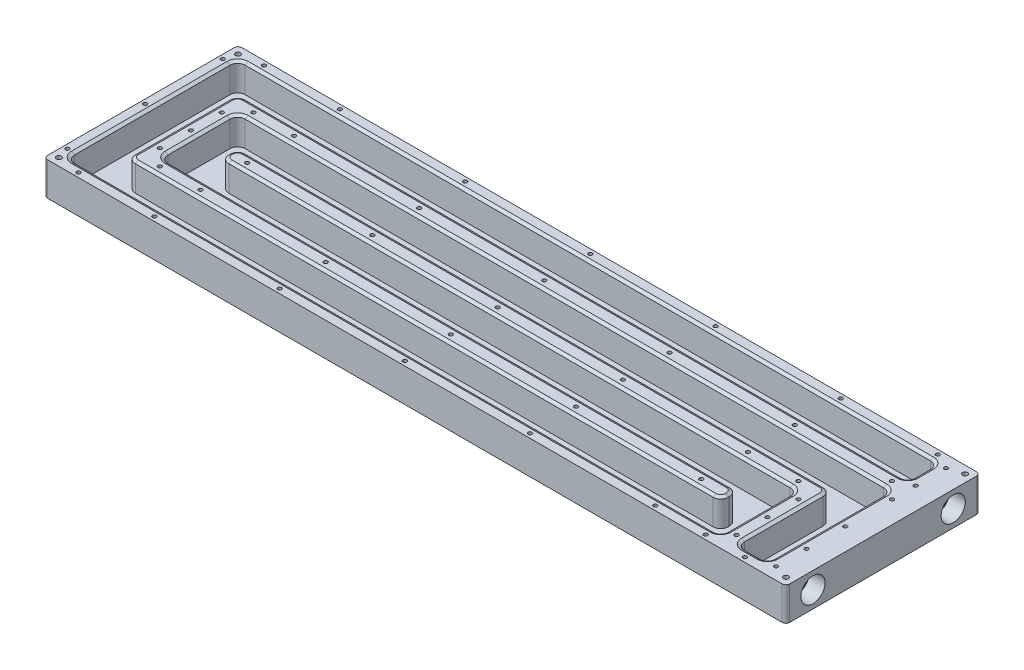
from build123d import *

# Parameters (mm, degrees)
SKETCH1_W                                  = 488.95
SKETCH1_H                                  = 134
BOSS_EXTRUDE1_DEPTH                        = 22
F_3_8_NPT_TAPPED_HOLE1_AT_2_COUNT          = 2
F_3_8_NPT_TAPPED_HOLE1_AT_2_PITCH          = 92.4
SKETCH4_W                                  = 461.45
SKETCH4_H                                  = 20
CUT_EXTRUDE1_DEPTH                         = 18
LPATTERN1_COUNT                            = 4
LPATTERN1_PITCH                            = 30.8
BOSS_EXTRUDE2_REACH                        = 256.443
SKETCH5_W                                  = 30.8
SKETCH5_H                                  = 20
BOSS_EXTRUDE3_REACH                        = 256.443
SKETCH6_W                                  = 30.8
SKETCH6_H                                  = 20
SKETCH7_W                                  = 20
SKETCH7_H                                  = 61.6
CUT_EXTRUDE2_DEPTH                         = 18
SKETCH8_W                                  = 20
SKETCH8_H                                  = 10.8
CUT_EXTRUDE3_DEPTH                         = 18
SKETCH9_W                                  = 20
SKETCH9_H                                  = 72.4
CUT_EXTRUDE4_DEPTH                         = 18
SKETCH10_W                                 = 20
SKETCH10_H                                 = 10.8
CUT_EXTRUDE5_DEPTH                         = 18
FILLET1_R                                  = 5
CHAMFER1_SIZE                              = 2
CHAMFER1_SIZE2                             = 1.154700538
TAP_DRILL_FOR_M3X0_5_PLATE_NEXT_MO_2_COUNT = 2
TAP_DRILL_FOR_M3X0_5_PLATE_NEXT_MO_2_PITCH = 61.6
LPATTERN2_COUNT                            = 5
LPATTERN2_PITCH                            = 97.75
SKETCH15_W                                 = 488.95
SKETCH15_H                                 = 3
CUT_EXTRUDE6_DEPTH                         = 255.442578247
SKETCH16_W                                 = 488.95
SKETCH16_H                                 = 3
CUT_EXTRUDE7_DEPTH                         = 255.442578247
FILLET2_R                                  = 2.5
TAP_DRILL_FOR_M3X0_5_TAP1_AT_2_COUNT       = 2
TAP_DRILL_FOR_M3X0_5_TAP1_AT_2_PITCH       = 30.8
TAP_DRILL_FOR_M3X0_5_TAP1_AT_3_COUNT       = 2
TAP_DRILL_FOR_M3X0_5_TAP1_AT_3_PITCH       = 61.1
TAP_DRILL_FOR_M3X0_5_TAP1_AT_4_COUNT       = 2
TAP_DRILL_FOR_M3X0_5_TAP1_AT_4_PITCH       = 30.8
TAP_DRILL_FOR_M3X0_5_TAP1_AT_5_COUNT       = 2
TAP_DRILL_FOR_M3X0_5_TAP1_AT_5_PITCH       = 61.1
LPATTERN3_COUNT                            = 5
LPATTERN3_PITCH                            = 82.5
TAP_DRILL_FOR_M3X0_5_TAP3_D                = 2.5
TAP_DRILL_FOR_M3X0_5_TAP3_DEPTH            = 10
TAP_DRILL_FOR_M3X0_5_TAP3_TIP              = 0.751075774
TAP_DRILL_FOR_M3X0_5_TAP4_D                = 2.5
TAP_DRILL_FOR_M3X0_5_TAP4_DEPTH            = 10
TAP_DRILL_FOR_M3X0_5_TAP4_TIP              = 0.751075774
TAP_DRILL_FOR_M4X0_7_TAP1_D                = 3.3
TAP_DRILL_FOR_M4X0_7_TAP1_DEPTH            = 17.38
TAP_DRILL_FOR_M4X0_7_TAP1_TIP              = 0.991420021
TAP_DRILL_FOR_M3X0_5_TAP5_D                = 2.5
TAP_DRILL_FOR_M3X0_5_TAP5_DEPTH            = 10
TAP_DRILL_FOR_M3X0_5_TAP5_TIP              = 0.751075774


with BuildPart() as part:
    # Sketch1 → Boss-Extrude1 (new body)
    with BuildSketch(Plane(origin=(0, 0, 0), x_dir=(1, 0, 0), z_dir=(0, 1, 0))):
        Rectangle(SKETCH1_W, SKETCH1_H)
    extrude(amount=BOSS_EXTRUDE1_DEPTH)

    # Sketch3 → 3/8 NPT Tapped Hole1 (revolve, cut)
    with BuildSketch(Plane(origin=(244.475, 11, 46.2), x_dir=(0, 0, -1), z_dir=(0, 1, 0))):
        Polygon((0, 0), (0, 21.668582582), (7.1374, 17.38), (7.1374, 10.33), (7.653732966, 10.33), (7.963027, 0), align=None)
    f_3_8_npt_tapped_hole1 = revolve(axis=Axis((250.825, 11, 46.2), (-1, 0, 0)), mode=Mode.SUBTRACT)

    # 3/8 NPT Tapped Hole1 at 2: 3/8 NPT Tapped Hole1 ×2
    with Locations(*[(0, 0, -i * F_3_8_NPT_TAPPED_HOLE1_AT_2_PITCH) for i in range(1, F_3_8_NPT_TAPPED_HOLE1_AT_2_COUNT)]):
        add(f_3_8_npt_tapped_hole1, mode=Mode.SUBTRACT)

    # Sketch4 → Cut-Extrude1 (cut)
    with BuildSketch(Plane(origin=(0, 22, 0), x_dir=(1, 0, 0), z_dir=(0, 1, 0))):
        with Locations((-6.25, 46.2)):
            Rectangle(SKETCH4_W, SKETCH4_H)
    cut_extrude1 = extrude(amount=-CUT_EXTRUDE1_DEPTH, mode=Mode.SUBTRACT)

    # LPattern1: Cut-Extrude1 ×4
    with Locations(*[(0, 0, i * LPATTERN1_PITCH) for i in range(1, LPATTERN1_COUNT)]):
        add(cut_extrude1, mode=Mode.SUBTRACT)

    # Sketch5 → Boss-Extrude2 (add, up to next)
    with BuildSketch(Plane(origin=(0, 22, 0), x_dir=(1, 0, 0), z_dir=(0, 1, 0)), mode=Mode.PRIVATE) as boss_extrude2_sk1:
        with Locations((-221.575, -15.4)):
            Rectangle(SKETCH5_W, SKETCH5_H)
    boss_extrude2_tool1 = extrude(boss_extrude2_sk1.sketch, amount=-BOSS_EXTRUDE2_REACH, mode=Mode.PRIVATE) - part.part
    # Sketch5 → Boss-Extrude2 (add, up to next)
    with BuildSketch(Plane(origin=(0, 22, 0), x_dir=(1, 0, 0), z_dir=(0, 1, 0)), mode=Mode.PRIVATE) as boss_extrude2_sk2:
        with Locations((-221.575, 15.4)):
            Rectangle(SKETCH5_W, SKETCH5_H)
    boss_extrude2_tool2 = extrude(boss_extrude2_sk2.sketch, amount=-BOSS_EXTRUDE2_REACH, mode=Mode.PRIVATE) - part.part
    add(boss_extrude2_tool1.solids().sort_by_distance((-221.575, 22, 15.4))[0])
    add(boss_extrude2_tool2.solids().sort_by_distance((-221.575, 22, -15.4))[0])

    # Sketch6 → Boss-Extrude3 (add, up to next)
    with BuildSketch(Plane(origin=(0, 22, 0), x_dir=(1, 0, 0), z_dir=(0, 1, 0)), mode=Mode.PRIVATE) as boss_extrude3_sk1:
        with Locations((209.075, -46.2)):
            Rectangle(SKETCH6_W, SKETCH6_H)
    boss_extrude3_tool1 = extrude(boss_extrude3_sk1.sketch, amount=-BOSS_EXTRUDE3_REACH, mode=Mode.PRIVATE) - part.part
    # Sketch6 → Boss-Extrude3 (add, up to next)
    with BuildSketch(Plane(origin=(0, 22, 0), x_dir=(1, 0, 0), z_dir=(0, 1, 0)), mode=Mode.PRIVATE) as boss_extrude3_sk2:
        with Locations((209.075, -15.4)):
            Rectangle(SKETCH6_W, SKETCH6_H)
    boss_extrude3_tool2 = extrude(boss_extrude3_sk2.sketch, amount=-BOSS_EXTRUDE3_REACH, mode=Mode.PRIVATE) - part.part
    add(boss_extrude3_tool1.solids().sort_by_distance((209.075, 22, 46.2))[0])
    add(boss_extrude3_tool2.solids().sort_by_distance((209.075, 22, 15.4))[0])

    # Sketch7 → Cut-Extrude2 (cut)
    with BuildSketch(Plane(origin=(0, 22, 0), x_dir=(1, 0, 0), z_dir=(0, 1, 0))):
        with Locations((214.475, -25.4)):
            Rectangle(SKETCH7_W, SKETCH7_H)
    extrude(amount=-CUT_EXTRUDE2_DEPTH, mode=Mode.SUBTRACT)

    # Sketch8 → Cut-Extrude3 (cut)
    with BuildSketch(Plane(origin=(0, 22, 0), x_dir=(1, 0, 0), z_dir=(0, 1, 0))):
        with Locations((183.675, -30.8)):
            Rectangle(SKETCH8_W, SKETCH8_H)
    extrude(amount=-CUT_EXTRUDE3_DEPTH, mode=Mode.SUBTRACT)

    # Sketch9 → Cut-Extrude4 (cut)
    with BuildSketch(Plane(origin=(0, 22, 0), x_dir=(1, 0, 0), z_dir=(0, 1, 0))):
        with Locations((-226.975, 0)):
            Rectangle(SKETCH9_W, SKETCH9_H)
    extrude(amount=-CUT_EXTRUDE4_DEPTH, mode=Mode.SUBTRACT)

    # Sketch10 → Cut-Extrude5 (cut)
    with BuildSketch(Plane(origin=(0, 22, 0), x_dir=(1, 0, 0), z_dir=(0, 1, 0))):
        with Locations((-196.175, 0)):
            Rectangle(SKETCH10_W, SKETCH10_H)
    extrude(amount=-CUT_EXTRUDE5_DEPTH, mode=Mode.SUBTRACT)

    # Fillet1
    fillet1_edges = [part.edges().sort_by_distance(p)[0] for p in [
        (-206.175, 13, 25.4),
        (193.675, 13, 5.4),
        (193.675, 13, 56.2),
        (204.475, 13, 56.2),
        (204.475, 13, -5.4),
        (224.475, 13, 56.2),
        (173.675, 13, 36.2),
        (173.675, 13, 25.4),
        (-216.975, 13, -36.2),
        (-216.975, 13, 36.2),
        (-186.175, 13, -5.4),
        (-186.175, 13, 5.4),
        (224.475, 13, -56.2),
        (224.475, 13, -36.2),
        (-236.975, 13, -56.2),
        (224.475, 13, -25.4),
        (-236.975, 13, 56.2),
        (-206.175, 13, -25.4),
    ]]
    fillet(fillet1_edges, radius=FILLET1_R)

    # Chamfer1
    chamfer1_edges = [part.edges().sort_by_distance(p)[0] for p in [
        (3.75, 22, 5.4),
        (193.675, 22, 30.8),
        (173.675, 22, 30.8),
        (-16.25, 22, 25.4),
        (-206.175, 22, 0),
        (9.15, 22, -25.4),
        (224.475, 22, 15.4),
        (214.475, 22, 56.2),
        (204.475, 22, 25.4),
        (9.15, 22, -5.4),
        (-186.175, 22, 0),
        (-21.65, 22, 56.2),
        (-236.975, 22, 0),
        (-6.25, 22, -56.2),
        (224.475, 22, -46.2),
        (3.75, 22, -36.2),
        (-216.975, 22, 0),
        (-21.65, 22, 36.2),
        (-184.710533906, 22, 3.935533906),
        (-184.710533906, 22, -3.935533906),
        (-215.510533906, 22, 34.735533906),
        (-215.510533906, 22, -34.735533906),
        (203.010533906, 22, -3.935533906),
        (172.210533906, 22, 34.735533906),
        (172.210533906, 22, 26.864466094),
        (192.210533906, 22, 6.864466094),
        (192.210533906, 22, 54.735533906),
        (205.939466094, 22, 54.735533906),
        (223.010533906, 22, 54.735533906),
        (223.010533906, 22, -23.935533906),
        (223.010533906, 22, -37.664466094),
        (223.010533906, 22, -54.735533906),
        (-235.510533906, 22, 54.735533906),
        (-204.710533906, 22, 23.935533906),
        (-204.710533906, 22, -23.935533906),
        (-235.510533906, 22, -54.735533906),
    ]]
    chamfer1_side = [part.faces().sort_by_distance(p)[0] for p in [
        (10.260026079, 22, -0.000428348),
    ]]
    chamfer(chamfer1_edges, length=CHAMFER1_SIZE, length2=CHAMFER1_SIZE2, reference=chamfer1_side[0])

    # Sketch14 → Tap Drill for M3x0.5 - Plate Next Mounts (revolve, cut)
    with BuildSketch(Plane(origin=(-191.975, 0, 30.8), x_dir=(0, 0, -1), z_dir=(1, 0, 0))):
        Polygon((0, 0), (0, 10.751075774), (1.25, 10), (1.25, 0), align=None)
    tap_drill_for_m3x0_5_plate_next_mounts = revolve(axis=Axis((-191.975, -6.35, 30.8), (0, 1, 0)), mode=Mode.SUBTRACT)

    # Tap Drill for M3x0.5 - Plate Next Mo 2: Tap Drill for M3x0.5 - Plate Next Mounts ×2
    with Locations(*[(0, 0, -i * TAP_DRILL_FOR_M3X0_5_PLATE_NEXT_MO_2_PITCH) for i in range(1, TAP_DRILL_FOR_M3X0_5_PLATE_NEXT_MO_2_COUNT)]):
        add(tap_drill_for_m3x0_5_plate_next_mounts, mode=Mode.SUBTRACT)

    # LPattern2: Tap Drill for M3x0.5 - Plate Next Mounts ×5
    with Locations(*[(i * LPATTERN2_PITCH, 0, 0) for i in range(1, LPATTERN2_COUNT)]):
        add(tap_drill_for_m3x0_5_plate_next_mounts, mode=Mode.SUBTRACT)

    # LPattern2 copy 1 sketch → LPattern2 copy 1 (revolve, cut)
    with BuildSketch(Plane(origin=(-94.225, 0, -30.8), x_dir=(0, 0, -1), z_dir=(1, 0, 0))):
        Polygon((0, 0), (0, 10.751075774), (1.25, 10), (1.25, 0), align=None)
    revolve(axis=Axis((-94.225, -6.35, -30.8), (0, 1, 0)), mode=Mode.SUBTRACT)

    # LPattern2 copy 2 sketch → LPattern2 copy 2 (revolve, cut)
    with BuildSketch(Plane(origin=(3.525, 0, -30.8), x_dir=(0, 0, -1), z_dir=(1, 0, 0))):
        Polygon((0, 0), (0, 10.751075774), (1.25, 10), (1.25, 0), align=None)
    revolve(axis=Axis((3.525, -6.35, -30.8), (0, 1, 0)), mode=Mode.SUBTRACT)

    # LPattern2 copy 3 sketch → LPattern2 copy 3 (revolve, cut)
    with BuildSketch(Plane(origin=(101.275, 0, -30.8), x_dir=(0, 0, -1), z_dir=(1, 0, 0))):
        Polygon((0, 0), (0, 10.751075774), (1.25, 10), (1.25, 0), align=None)
    revolve(axis=Axis((101.275, -6.35, -30.8), (0, 1, 0)), mode=Mode.SUBTRACT)

    # LPattern2 copy 4 sketch → LPattern2 copy 4 (revolve, cut)
    with BuildSketch(Plane(origin=(199.025, 0, -30.8), x_dir=(0, 0, -1), z_dir=(1, 0, 0))):
        Polygon((0, 0), (0, 10.751075774), (1.25, 10), (1.25, 0), align=None)
    revolve(axis=Axis((199.025, -6.35, -30.8), (0, 1, 0)), mode=Mode.SUBTRACT)

    # Sketch15 → Cut-Extrude6 (cut, through all)
    with BuildSketch(Plane(origin=(0, 22, 0), x_dir=(1, 0, 0), z_dir=(0, 1, 0))):
        with Locations((0, -65.5)):
            Rectangle(SKETCH15_W, SKETCH15_H)
    extrude(amount=-CUT_EXTRUDE6_DEPTH, mode=Mode.SUBTRACT)

    # Sketch16 → Cut-Extrude7 (cut, through all)
    with BuildSketch(Plane(origin=(0, 22, 0), x_dir=(1, 0, 0), z_dir=(0, 1, 0))):
        with Locations((0, 65.5)):
            Rectangle(SKETCH16_W, SKETCH16_H)
    extrude(amount=-CUT_EXTRUDE7_DEPTH, mode=Mode.SUBTRACT)

    # Fillet2
    fillet2_edges = [part.edges().sort_by_distance(p)[0] for p in [
        (244.475, 11, 64),
        (-244.475, 11, 64),
        (244.475, 11, -64),
        (-244.475, 11, -64),
    ]]
    fillet(fillet2_edges, radius=FILLET2_R)

    # Sketch12 → Tap Drill for M3x0.5 Tap1 (revolve, cut)
    with BuildSketch(Plane(origin=(-174.475, 22, 0), x_dir=(0, 0, 1), z_dir=(1, 0, 0))):
        Polygon((0, 0), (0, 10.751075774), (1.25, 10), (1.25, 0), align=None)
    tap_drill_for_m3x0_5_tap1 = revolve(axis=Axis((-174.475, 28.35, 0), (0, -1, 0)), mode=Mode.SUBTRACT)

    # Tap Drill for M3x0.5 Tap1 at 2: Tap Drill for M3x0.5 Tap1 ×2
    with Locations(*[(0, 0, i * TAP_DRILL_FOR_M3X0_5_TAP1_AT_2_PITCH) for i in range(1, TAP_DRILL_FOR_M3X0_5_TAP1_AT_2_COUNT)]):
        add(tap_drill_for_m3x0_5_tap1, mode=Mode.SUBTRACT)

    # Tap Drill for M3x0.5 Tap1 at 3: Tap Drill for M3x0.5 Tap1 ×2
    with Locations(*[(0, 0, i * TAP_DRILL_FOR_M3X0_5_TAP1_AT_3_PITCH) for i in range(1, TAP_DRILL_FOR_M3X0_5_TAP1_AT_3_COUNT)]):
        add(tap_drill_for_m3x0_5_tap1, mode=Mode.SUBTRACT)

    # Tap Drill for M3x0.5 Tap1 at 4: Tap Drill for M3x0.5 Tap1 ×2
    with Locations(*[(0, 0, -i * TAP_DRILL_FOR_M3X0_5_TAP1_AT_4_PITCH) for i in range(1, TAP_DRILL_FOR_M3X0_5_TAP1_AT_4_COUNT)]):
        add(tap_drill_for_m3x0_5_tap1, mode=Mode.SUBTRACT)

    # Tap Drill for M3x0.5 Tap1 at 5: Tap Drill for M3x0.5 Tap1 ×2
    with Locations(*[(0, 0, -i * TAP_DRILL_FOR_M3X0_5_TAP1_AT_5_PITCH) for i in range(1, TAP_DRILL_FOR_M3X0_5_TAP1_AT_5_COUNT)]):
        add(tap_drill_for_m3x0_5_tap1, mode=Mode.SUBTRACT)

    # LPattern3: Tap Drill for M3x0.5 Tap1 ×5
    with Locations(*[(i * LPATTERN3_PITCH, 0, 0) for i in range(1, LPATTERN3_COUNT)]):
        add(tap_drill_for_m3x0_5_tap1, mode=Mode.SUBTRACT)

    # LPattern3 copy 1 sketch → LPattern3 copy 1 (revolve, cut)
    with BuildSketch(Plane(origin=(-91.975, 22, 30.8), x_dir=(0, 0, 1), z_dir=(1, 0, 0))):
        Polygon((0, 0), (0, 10.751075774), (1.25, 10), (1.25, 0), align=None)
    revolve(axis=Axis((-91.975, 28.35, 30.8), (0, -1, 0)), mode=Mode.SUBTRACT)

    # LPattern3 copy 2 sketch → LPattern3 copy 2 (revolve, cut)
    with BuildSketch(Plane(origin=(-9.475, 22, 30.8), x_dir=(0, 0, 1), z_dir=(1, 0, 0))):
        Polygon((0, 0), (0, 10.751075774), (1.25, 10), (1.25, 0), align=None)
    revolve(axis=Axis((-9.475, 28.35, 30.8), (0, -1, 0)), mode=Mode.SUBTRACT)

    # LPattern3 copy 3 sketch → LPattern3 copy 3 (revolve, cut)
    with BuildSketch(Plane(origin=(73.025, 22, 30.8), x_dir=(0, 0, 1), z_dir=(1, 0, 0))):
        Polygon((0, 0), (0, 10.751075774), (1.25, 10), (1.25, 0), align=None)
    revolve(axis=Axis((73.025, 28.35, 30.8), (0, -1, 0)), mode=Mode.SUBTRACT)

    # LPattern3 copy 4 sketch → LPattern3 copy 4 (revolve, cut)
    with BuildSketch(Plane(origin=(155.525, 22, 30.8), x_dir=(0, 0, 1), z_dir=(1, 0, 0))):
        Polygon((0, 0), (0, 10.751075774), (1.25, 10), (1.25, 0), align=None)
    revolve(axis=Axis((155.525, 28.35, 30.8), (0, -1, 0)), mode=Mode.SUBTRACT)

    # LPattern3 copy 5 sketch → LPattern3 copy 5 (revolve, cut)
    with BuildSketch(Plane(origin=(-91.975, 22, 61.1), x_dir=(0, 0, 1), z_dir=(1, 0, 0))):
        Polygon((0, 0), (0, 10.751075774), (1.25, 10), (1.25, 0), align=None)
    revolve(axis=Axis((-91.975, 28.35, 61.1), (0, -1, 0)), mode=Mode.SUBTRACT)

    # LPattern3 copy 6 sketch → LPattern3 copy 6 (revolve, cut)
    with BuildSketch(Plane(origin=(-9.475, 22, 61.1), x_dir=(0, 0, 1), z_dir=(1, 0, 0))):
        Polygon((0, 0), (0, 10.751075774), (1.25, 10), (1.25, 0), align=None)
    revolve(axis=Axis((-9.475, 28.35, 61.1), (0, -1, 0)), mode=Mode.SUBTRACT)

    # LPattern3 copy 7 sketch → LPattern3 copy 7 (revolve, cut)
    with BuildSketch(Plane(origin=(73.025, 22, 61.1), x_dir=(0, 0, 1), z_dir=(1, 0, 0))):
        Polygon((0, 0), (0, 10.751075774), (1.25, 10), (1.25, 0), align=None)
    revolve(axis=Axis((73.025, 28.35, 61.1), (0, -1, 0)), mode=Mode.SUBTRACT)

    # LPattern3 copy 8 sketch → LPattern3 copy 8 (revolve, cut)
    with BuildSketch(Plane(origin=(155.525, 22, 61.1), x_dir=(0, 0, 1), z_dir=(1, 0, 0))):
        Polygon((0, 0), (0, 10.751075774), (1.25, 10), (1.25, 0), align=None)
    revolve(axis=Axis((155.525, 28.35, 61.1), (0, -1, 0)), mode=Mode.SUBTRACT)

    # LPattern3 copy 9 sketch → LPattern3 copy 9 (revolve, cut)
    with BuildSketch(Plane(origin=(-91.975, 22, -30.8), x_dir=(0, 0, 1), z_dir=(1, 0, 0))):
        Polygon((0, 0), (0, 10.751075774), (1.25, 10), (1.25, 0), align=None)
    revolve(axis=Axis((-91.975, 28.35, -30.8), (0, -1, 0)), mode=Mode.SUBTRACT)

    # LPattern3 copy 10 sketch → LPattern3 copy 10 (revolve, cut)
    with BuildSketch(Plane(origin=(-9.475, 22, -30.8), x_dir=(0, 0, 1), z_dir=(1, 0, 0))):
        Polygon((0, 0), (0, 10.751075774), (1.25, 10), (1.25, 0), align=None)
    revolve(axis=Axis((-9.475, 28.35, -30.8), (0, -1, 0)), mode=Mode.SUBTRACT)

    # LPattern3 copy 11 sketch → LPattern3 copy 11 (revolve, cut)
    with BuildSketch(Plane(origin=(73.025, 22, -30.8), x_dir=(0, 0, 1), z_dir=(1, 0, 0))):
        Polygon((0, 0), (0, 10.751075774), (1.25, 10), (1.25, 0), align=None)
    revolve(axis=Axis((73.025, 28.35, -30.8), (0, -1, 0)), mode=Mode.SUBTRACT)

    # LPattern3 copy 12 sketch → LPattern3 copy 12 (revolve, cut)
    with BuildSketch(Plane(origin=(155.525, 22, -30.8), x_dir=(0, 0, 1), z_dir=(1, 0, 0))):
        Polygon((0, 0), (0, 10.751075774), (1.25, 10), (1.25, 0), align=None)
    revolve(axis=Axis((155.525, 28.35, -30.8), (0, -1, 0)), mode=Mode.SUBTRACT)

    # LPattern3 copy 13 sketch → LPattern3 copy 13 (revolve, cut)
    with BuildSketch(Plane(origin=(-91.975, 22, -61.1), x_dir=(0, 0, 1), z_dir=(1, 0, 0))):
        Polygon((0, 0), (0, 10.751075774), (1.25, 10), (1.25, 0), align=None)
    revolve(axis=Axis((-91.975, 28.35, -61.1), (0, -1, 0)), mode=Mode.SUBTRACT)

    # LPattern3 copy 14 sketch → LPattern3 copy 14 (revolve, cut)
    with BuildSketch(Plane(origin=(-9.475, 22, -61.1), x_dir=(0, 0, 1), z_dir=(1, 0, 0))):
        Polygon((0, 0), (0, 10.751075774), (1.25, 10), (1.25, 0), align=None)
    revolve(axis=Axis((-9.475, 28.35, -61.1), (0, -1, 0)), mode=Mode.SUBTRACT)

    # LPattern3 copy 15 sketch → LPattern3 copy 15 (revolve, cut)
    with BuildSketch(Plane(origin=(73.025, 22, -61.1), x_dir=(0, 0, 1), z_dir=(1, 0, 0))):
        Polygon((0, 0), (0, 10.751075774), (1.25, 10), (1.25, 0), align=None)
    revolve(axis=Axis((73.025, 28.35, -61.1), (0, -1, 0)), mode=Mode.SUBTRACT)

    # LPattern3 copy 16 sketch → LPattern3 copy 16 (revolve, cut)
    with BuildSketch(Plane(origin=(155.525, 22, -61.1), x_dir=(0, 0, 1), z_dir=(1, 0, 0))):
        Polygon((0, 0), (0, 10.751075774), (1.25, 10), (1.25, 0), align=None)
    revolve(axis=Axis((155.525, 28.35, -61.1), (0, -1, 0)), mode=Mode.SUBTRACT)

    # Tap Drill for M3x0.5 Tap3
    with Locations(Plane(origin=(0, 22, 0), x_dir=(1, 0, 0), z_dir=(0, 1, 0))):
        with Locations((199.075, -30.8), (188.675, 0), (199.075, -10.4), (199.075, -51.2), (188.675, -61.1)):
            Hole(TAP_DRILL_FOR_M3X0_5_TAP3_D / 2, depth=TAP_DRILL_FOR_M3X0_5_TAP3_DEPTH)
            with Locations((0, 0, -(TAP_DRILL_FOR_M3X0_5_TAP3_DEPTH + TAP_DRILL_FOR_M3X0_5_TAP3_TIP / 2))):  # 118° drill point
                Cone(0, TAP_DRILL_FOR_M3X0_5_TAP3_D / 2, TAP_DRILL_FOR_M3X0_5_TAP3_TIP, mode=Mode.SUBTRACT)

    # Tap Drill for M3x0.5 Tap4
    with Locations(Plane(origin=(0, 22, 0), x_dir=(1, 0, 0), z_dir=(0, 1, 0))):
        with Locations((219.475, 61.1), (219.475, 30.8), (229.975, 36), (229.975, 56), (229.975, 20.4), (229.975, -10.4), (229.975, -36), (229.975, -56), (214.475, -61.1)):
            Hole(TAP_DRILL_FOR_M3X0_5_TAP4_D / 2, depth=TAP_DRILL_FOR_M3X0_5_TAP4_DEPTH)
            with Locations((0, 0, -(TAP_DRILL_FOR_M3X0_5_TAP4_DEPTH + TAP_DRILL_FOR_M3X0_5_TAP4_TIP / 2))):  # 118° drill point
                Cone(0, TAP_DRILL_FOR_M3X0_5_TAP4_D / 2, TAP_DRILL_FOR_M3X0_5_TAP4_TIP, mode=Mode.SUBTRACT)

    # Tap Drill for M4x0.7 Tap1
    with Locations(Plane(origin=(0, 22, 0), x_dir=(1, 0, 0), z_dir=(0, 1, 0))):
        with Locations((239.475, -59), (239.475, 59), (-239.475, 59), (-239.475, -59)):
            Hole(TAP_DRILL_FOR_M4X0_7_TAP1_D / 2, depth=TAP_DRILL_FOR_M4X0_7_TAP1_DEPTH)
            with Locations((0, 0, -(TAP_DRILL_FOR_M4X0_7_TAP1_DEPTH + TAP_DRILL_FOR_M4X0_7_TAP1_TIP / 2))):  # 118° drill point
                Cone(0, TAP_DRILL_FOR_M4X0_7_TAP1_D / 2, TAP_DRILL_FOR_M4X0_7_TAP1_TIP, mode=Mode.SUBTRACT)

    # Tap Drill for M3x0.5 Tap5
    with Locations(Plane(origin=(0, 22, 0), x_dir=(1, 0, 0), z_dir=(0, 1, 0))):
        with Locations((-211.575, 0), (-211.575, -20.4), (-211.575, 20.4), (-201.175, 30.8), (-201.175, -30.8), (-224.475, -61.1), (-241.725, -51.2), (-241.725, 0), (-241.725, 51.2), (-224.475, 61.1)):
            Hole(TAP_DRILL_FOR_M3X0_5_TAP5_D / 2, depth=TAP_DRILL_FOR_M3X0_5_TAP5_DEPTH)
            with Locations((0, 0, -(TAP_DRILL_FOR_M3X0_5_TAP5_DEPTH + TAP_DRILL_FOR_M3X0_5_TAP5_TIP / 2))):  # 118° drill point
                Cone(0, TAP_DRILL_FOR_M3X0_5_TAP5_D / 2, TAP_DRILL_FOR_M3X0_5_TAP5_TIP, mode=Mode.SUBTRACT)


solid = part.part
